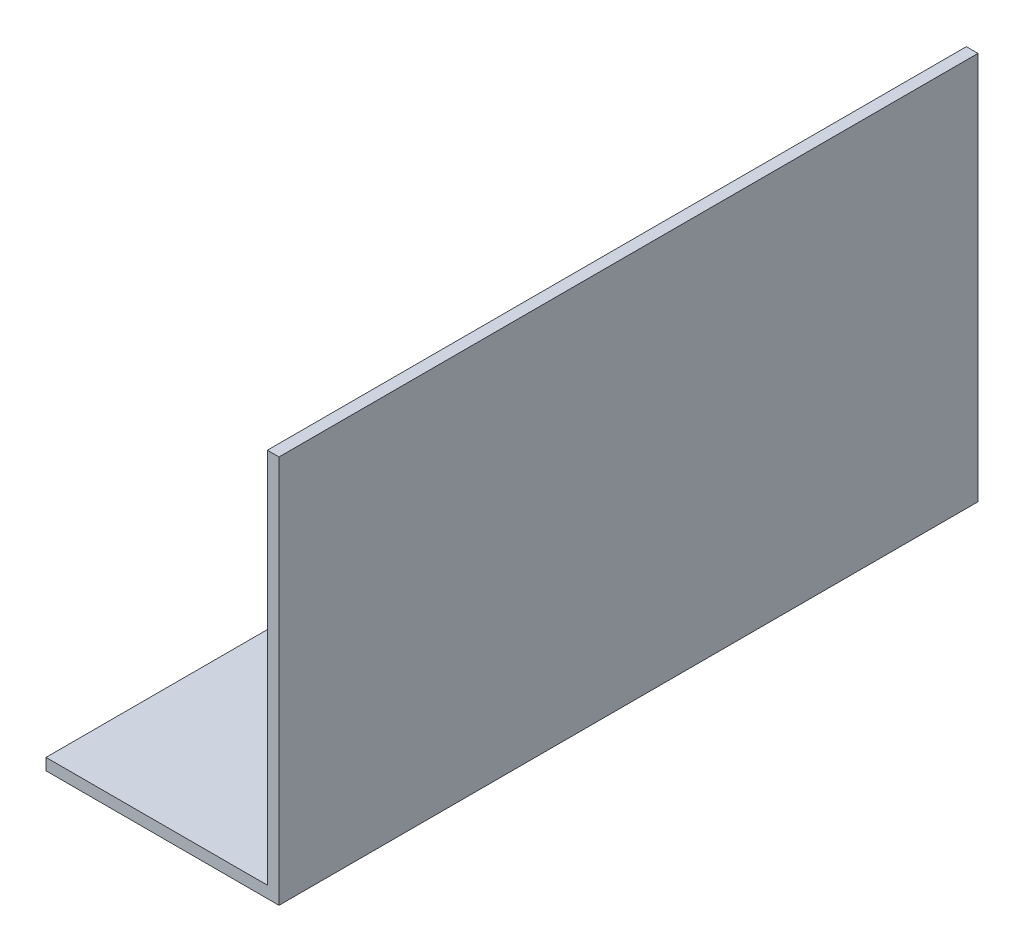
from build123d import *

# Parameters (mm, degrees)
BOSS_EXTRUDE1_DEPTH = 180


with BuildPart() as part:
    # Sketch1 → Boss-Extrude1 (new body)
    with BuildSketch(Plane.XY):
        Polygon((-12.181480378, -30.334485842), (44.818519622, -30.334485842), (44.818519622, 66.665514158), (47.818519622, 66.665514158), (47.818519622, -33.334485842), (-12.181480378, -33.334485842), align=None)
    extrude(amount=BOSS_EXTRUDE1_DEPTH)


solid = part.part
